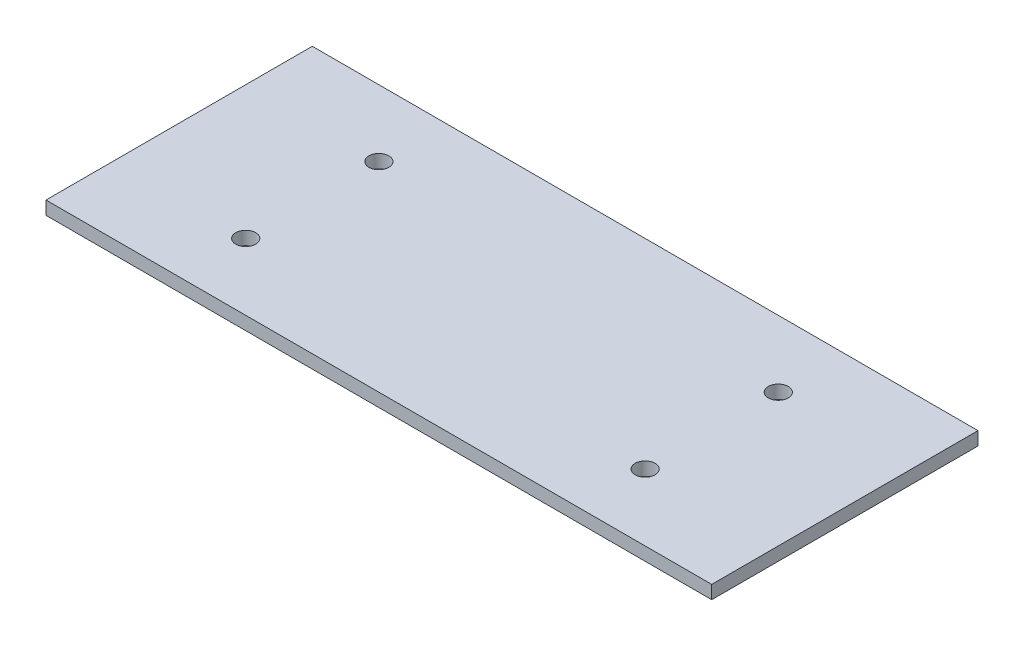
from build123d import *

# Parameters (mm, degrees)
SKETCH1_W           = 100
SKETCH1_H           = 40
SKETCH1_R           = 1.5
BOSS_EXTRUDE1_DEPTH = 2


with BuildPart() as part:
    # Sketch1 → Boss-Extrude1 (new body)
    with BuildSketch(Plane(origin=(0, 0, 0), x_dir=(1, 0, 0), z_dir=(0, 1, 0))):
        with Locations((50, 20)):
            Rectangle(SKETCH1_W, SKETCH1_H)
        with Locations(Location((80, 30, 0), (0, 0, 270))):
            Circle(SKETCH1_R, mode=Mode.SUBTRACT)
        with Locations(Location((20, 30, 0), (0, 0, 270))):
            Circle(SKETCH1_R, mode=Mode.SUBTRACT)
        with Locations(Location((80, 10, 0), (0, 0, 270))):
            Circle(SKETCH1_R, mode=Mode.SUBTRACT)
        with Locations(Location((20, 10, 0), (0, 0, 270))):
            Circle(SKETCH1_R, mode=Mode.SUBTRACT)
    extrude(amount=BOSS_EXTRUDE1_DEPTH)


solid = part.part
